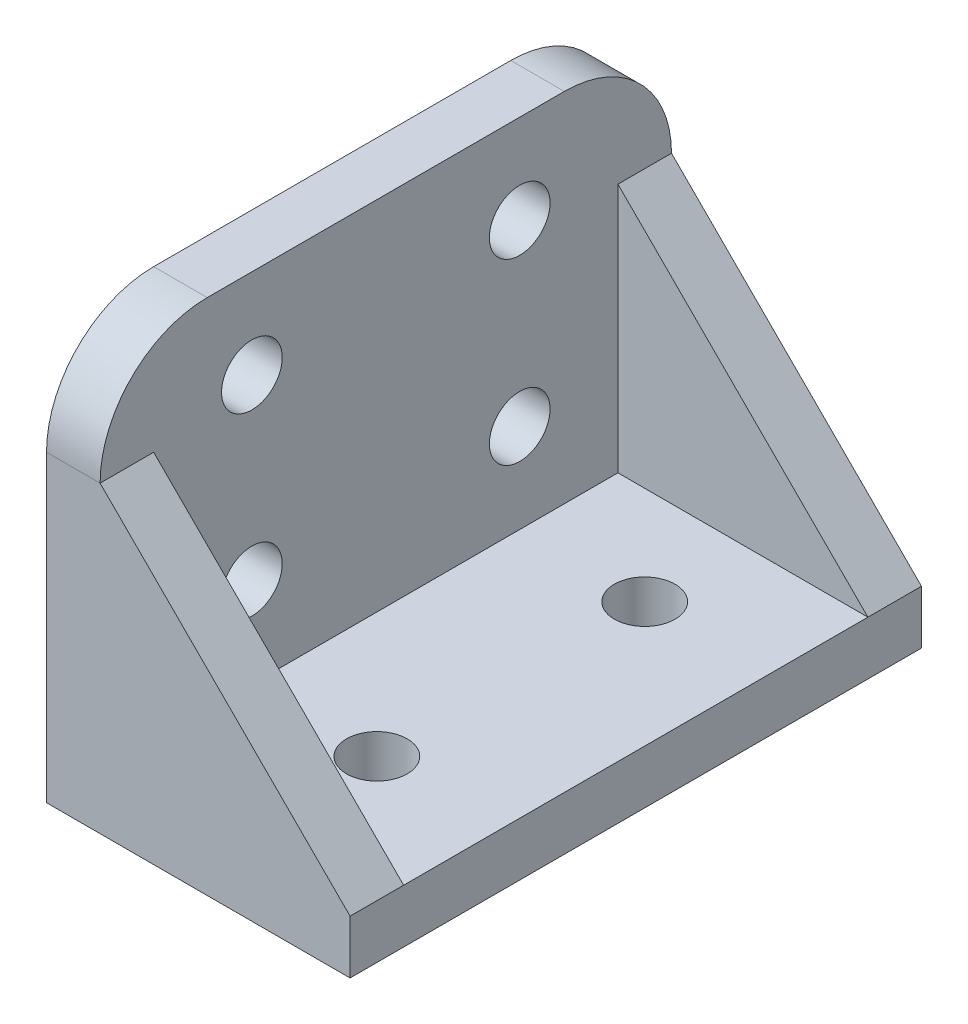
from build123d import *

# Parameters (mm, degrees)
PROFILE_EXTRUDE_DEPTH     = 32
GUSSET_1_EXTRUDE_DEPTH    = 3
GUSSET_START              = 29
GUSSET_2_EXTRUDE_DEPTH    = 3
SOLENOID_MOUNTING_HOLES_D = 3.4
M3_MOUNTING_HOLES_D       = 3.4
CORNER_FILLETS_R          = 6


with BuildPart() as part:
    # Profile Sketch → Profile  Extrude (new body)
    with BuildSketch(Plane.XY):
        Polygon((0, 0), (0, 20), (-3, 20), (-3, -3), (14, -3), (14, 0), align=None)
    extrude(amount=PROFILE_EXTRUDE_DEPTH)

    # Gusset Sketch → Gusset 1 Extrude (add)
    with BuildSketch(Plane.XY):
        Polygon((0, 0), (14, 0), (0, 14), align=None)
    extrude(amount=GUSSET_1_EXTRUDE_DEPTH)

    # Gusset Sketch<2> → Gusset 2 Extrude (add)
    with BuildSketch(Plane.XY.offset(GUSSET_START)):
        Polygon((0, 0), (14, 0), (0, 14), align=None)
    extrude(amount=GUSSET_2_EXTRUDE_DEPTH)

    # Solenoid Mounting Holes (through all)
    with Locations(Plane(origin=(0, 0, 0), x_dir=(0, 0, -1), z_dir=(1, 0, 0))):
        with Locations((-8.5, 15), (-23.5, 15), (-23.5, 5), (-8.5, 5)):
            Hole(SOLENOID_MOUNTING_HOLES_D / 2)

    # M3 Mounting Holes (through all)
    with Locations(Plane(origin=(0, 0, 0), x_dir=(1, 0, 0), z_dir=(0, 1, 0))):
        with Locations((7, -23.5), (7, -8.5)):
            Hole(M3_MOUNTING_HOLES_D / 2)

    # Corner Fillets
    corner_fillets_edges = [part.edges().sort_by_distance(p)[0] for p in [
        (-1.5, 20, 0),
        (-1.5, 20, 32),
    ]]
    fillet(corner_fillets_edges, radius=CORNER_FILLETS_R)


solid = part.part
